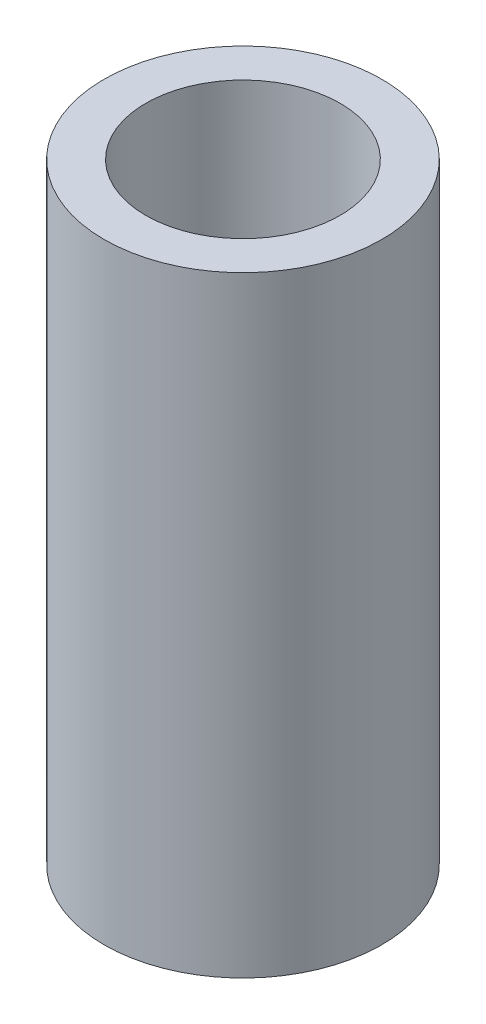
from build123d import *

# Parameters (mm, degrees)
SKETCH1_R           = 2.5
SKETCH1_R_2         = 1.75
BOSS_EXTRUDE1_DEPTH = 11


with BuildPart() as part:
    # Sketch1 → Boss-Extrude1 (new body)
    with BuildSketch(Plane(origin=(0, 0, 0), x_dir=(1, 0, 0), z_dir=(0, 1, 0))):
        with Locations(Location((0, 0, 0), (0, 0, 270))):
            Circle(SKETCH1_R)
        with Locations(Location((0, 0, 0), (0, 0, 270))):
            Circle(SKETCH1_R_2, mode=Mode.SUBTRACT)
    extrude(amount=BOSS_EXTRUDE1_DEPTH)


solid = part.part
